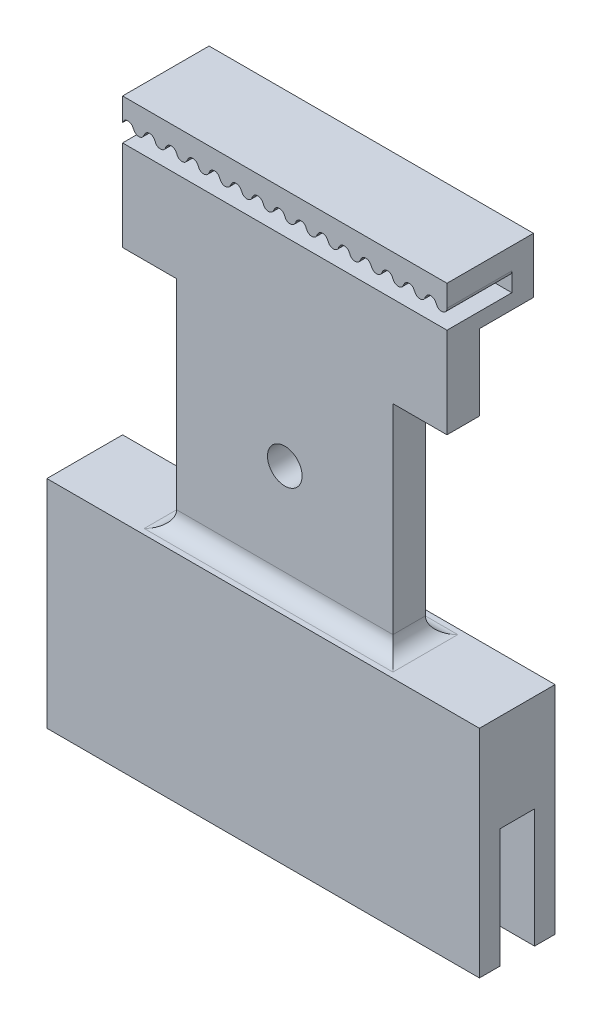
from build123d import *

# Parameters (mm, degrees)
IZIM1_W                          = 40
IZIM1_H                          = 7
Y_KSEKLIK_EKSTR_ZYON1_DEPTH      = 20
IZIM2_W                          = 40
IZIM2_H                          = 3.2
KES_EKSTR_ZYON1_DEPTH            = 11
Y_KSEKLIK_EKSTR_ZYON2_DEPTH      = 1.5
Y_KSEKLIK_EKSTR_ZYON2_DEPTH_BACK = 1.5
IZIM4_W                          = 20
IZIM4_H                          = 20
IZIM4_R                          = 1.6
RADYUS1_R                        = 1.5
IZIM7_W                          = 30
IZIM7_H                          = 3
Y_KSEKLIK_EKSTR_ZYON4_DEPTH      = 7
Y_KSEKLIK_EKSTR_ZYON6_DEPTH      = 3
Y_KSEKLIK_EKSTR_ZYON6_DEPTH_BACK = 3
IZIM9_W                          = 30
IZIM9_H                          = 1.38
IZIM10_W                         = 30
IZIM10_H                         = 5.14
Y_KSEKLIK_EKSTR_ZYON7_DEPTH      = 2


with BuildPart() as part:
    # Çizim1 → Yükseklik-Ekstrüzyon1 (new body)
    with BuildSketch(Plane(origin=(0, 0, 0), x_dir=(1, 0, 0), z_dir=(0, 1, 0))):
        Rectangle(IZIM1_W, IZIM1_H)
    extrude(amount=-Y_KSEKLIK_EKSTR_ZYON1_DEPTH)

    # Çizim2 → Kes-Ekstrüzyon1 (cut)
    with BuildSketch(Plane.XZ.offset(20)):
        Rectangle(IZIM2_W, IZIM2_H)
    extrude(amount=-KES_EKSTR_ZYON1_DEPTH, mode=Mode.SUBTRACT)

    # Çizim4 → Yükseklik-Ekstrüzyon2 (add, two sides: drawn at the far end of the back side and taken through both)
    with BuildSketch(Plane.XY.offset(-Y_KSEKLIK_EKSTR_ZYON2_DEPTH_BACK)):
        with Locations((0, 10)):
            Rectangle(IZIM4_W, IZIM4_H)
        with Locations((0, 10)):
            Circle(IZIM4_R, mode=Mode.SUBTRACT)
    extrude(amount=Y_KSEKLIK_EKSTR_ZYON2_DEPTH + Y_KSEKLIK_EKSTR_ZYON2_DEPTH_BACK)

    # Radyus1
    radyus1_edges = [part.edges().sort_by_distance(p)[0] for p in [
        (-10, 0, 0),
        (10, 0, 0),
        (0, 0, -1.5),
        (0, 0, 1.5),
    ]]
    fillet(radyus1_edges, radius=RADYUS1_R)

    # Çizim7 → Yükseklik-Ekstrüzyon4 (add)
    with BuildSketch(Plane(origin=(0, 20, 0), x_dir=(1, 0, 0), z_dir=(0, 1, 0))):
        Rectangle(IZIM7_W, IZIM7_H)
    extrude(amount=Y_KSEKLIK_EKSTR_ZYON4_DEPTH)

    # Çizim9 → Yükseklik-Ekstrüzyon6 (add, two sides: drawn at the far end of the back side and taken through both)
    with BuildSketch(Plane(origin=(0, 0, -1.5), x_dir=(-1, 0, 0), z_dir=(0, 0, -1)).offset(-Y_KSEKLIK_EKSTR_ZYON6_DEPTH_BACK)):
        with BuildLine():
            Line((15, 32.14), (-15, 32.14))
            Line((-15, 32.14), (-15, 30.13))
            ThreePointArc((-15, 30.13), (-14.856482323, 29.783517677), (-14.51, 29.64))
            Line((-14.51, 29.64), (-14.49, 29.64))
            ThreePointArc((-14.49, 29.64), (-14.181169533, 29.749574261), (-14.010460986, 30.029290846))
            Line((-14.010460986, 30.029290846), (-13.982635036, 30.029290846))
            ThreePointArc((-13.982635036, 30.029290846), (-13.807277215, 30.289520548), (-13.51, 30.39))
            Line((-13.51, 30.39), (-13.49, 30.39))
            ThreePointArc((-13.49, 30.39), (-13.192722785, 30.289520548), (-13.017364964, 30.029290846))
            Line((-13.017364964, 30.029290846), (-12.989539014, 30.029290846))
            ThreePointArc((-12.989539014, 30.029290846), (-12.818830467, 29.749574261), (-12.51, 29.64))
            Line((-12.51, 29.64), (-12.49, 29.64))
            ThreePointArc((-12.49, 29.64), (-12.181169533, 29.749574261), (-12.010460986, 30.029290846))
            Line((-12.010460986, 30.029290846), (-11.982635036, 30.029290846))
            ThreePointArc((-11.982635036, 30.029290846), (-11.807277215, 30.289520548), (-11.51, 30.39))
            Line((-11.51, 30.39), (-11.49, 30.39))
            ThreePointArc((-11.49, 30.39), (-11.192722785, 30.289520548), (-11.017364964, 30.029290846))
            Line((-11.017364964, 30.029290846), (-10.989539014, 30.029290846))
            ThreePointArc((-10.989539014, 30.029290846), (-10.818830467, 29.749574261), (-10.51, 29.64))
            Line((-10.51, 29.64), (-10.49, 29.64))
            ThreePointArc((-10.49, 29.64), (-10.181169533, 29.749574261), (-10.010460986, 30.029290846))
            Line((-10.010460986, 30.029290846), (-9.982635036, 30.029290846))
            ThreePointArc((-9.982635036, 30.029290846), (-9.807277215, 30.289520548), (-9.51, 30.39))
            Line((-9.51, 30.39), (-9.49, 30.39))
            ThreePointArc((-9.49, 30.39), (-9.192722785, 30.289520548), (-9.017364964, 30.029290846))
            Line((-9.017364964, 30.029290846), (-8.989539014, 30.029290846))
            ThreePointArc((-8.989539014, 30.029290846), (-8.818830467, 29.749574261), (-8.51, 29.64))
            Line((-8.51, 29.64), (-8.49, 29.64))
            ThreePointArc((-8.49, 29.64), (-8.181169533, 29.749574261), (-8.010460986, 30.029290846))
            Line((-8.010460986, 30.029290846), (-7.982635036, 30.029290846))
            ThreePointArc((-7.982635036, 30.029290846), (-7.807277215, 30.289520548), (-7.51, 30.39))
            Line((-7.51, 30.39), (-7.49, 30.39))
            ThreePointArc((-7.49, 30.39), (-7.192722785, 30.289520548), (-7.017364964, 30.029290846))
            Line((-7.017364964, 30.029290846), (-6.989539014, 30.029290846))
            ThreePointArc((-6.989539014, 30.029290846), (-6.818830467, 29.749574261), (-6.51, 29.64))
            Line((-6.51, 29.64), (-6.49, 29.64))
            ThreePointArc((-6.49, 29.64), (-6.181169533, 29.749574261), (-6.010460986, 30.029290846))
            Line((-6.010460986, 30.029290846), (-5.982635036, 30.029290846))
            ThreePointArc((-5.982635036, 30.029290846), (-5.807277215, 30.289520548), (-5.51, 30.39))
            Line((-5.51, 30.39), (-5.49, 30.39))
            ThreePointArc((-5.49, 30.39), (-5.192722785, 30.289520548), (-5.017364964, 30.029290846))
            Line((-5.017364964, 30.029290846), (-4.989539014, 30.029290846))
            ThreePointArc((-4.989539014, 30.029290846), (-4.818830467, 29.749574261), (-4.51, 29.64))
            Line((-4.51, 29.64), (-4.49, 29.64))
            ThreePointArc((-4.49, 29.64), (-4.181169533, 29.749574261), (-4.010460986, 30.029290846))
            Line((-4.010460986, 30.029290846), (-3.982635036, 30.029290846))
            ThreePointArc((-3.982635036, 30.029290846), (-3.807277215, 30.289520548), (-3.51, 30.39))
            Line((-3.51, 30.39), (-3.49, 30.39))
            ThreePointArc((-3.49, 30.39), (-3.192722785, 30.289520548), (-3.017364964, 30.029290846))
            Line((-3.017364964, 30.029290846), (-2.989539014, 30.029290846))
            ThreePointArc((-2.989539014, 30.029290846), (-2.818830467, 29.749574261), (-2.51, 29.64))
            Line((-2.51, 29.64), (-2.49, 29.64))
            ThreePointArc((-2.49, 29.64), (-2.181169533, 29.749574261), (-2.010460986, 30.029290846))
            Line((-2.010460986, 30.029290846), (-1.982635036, 30.029290846))
            ThreePointArc((-1.982635036, 30.029290846), (-1.807277215, 30.289520548), (-1.51, 30.39))
            Line((-1.51, 30.39), (-1.49, 30.39))
            ThreePointArc((-1.49, 30.39), (-1.192722785, 30.289520548), (-1.017364964, 30.029290846))
            Line((-1.017364964, 30.029290846), (-0.989539014, 30.029290846))
            ThreePointArc((-0.989539014, 30.029290846), (-0.818830467, 29.749574261), (-0.51, 29.64))
            Line((-0.51, 29.64), (-0.49, 29.64))
            ThreePointArc((-0.49, 29.64), (-0.181169533, 29.749574261), (-0.010460986, 30.029290846))
            Line((-0.010460986, 30.029290846), (0.017364964, 30.029290846))
            ThreePointArc((0.017364964, 30.029290846), (0.192722785, 30.289520548), (0.49, 30.39))
            Line((0.49, 30.39), (0.51, 30.39))
            ThreePointArc((0.51, 30.39), (0.807277215, 30.289520548), (0.982635036, 30.029290846))
            Line((0.982635036, 30.029290846), (1.010460986, 30.029290846))
            ThreePointArc((1.010460986, 30.029290846), (1.181169533, 29.749574261), (1.49, 29.64))
            Line((1.49, 29.64), (1.51, 29.64))
            ThreePointArc((1.51, 29.64), (1.818830467, 29.749574261), (1.989539014, 30.029290846))
            Line((1.989539014, 30.029290846), (2.017364964, 30.029290846))
            ThreePointArc((2.017364964, 30.029290846), (2.192722785, 30.289520548), (2.49, 30.39))
            Line((2.49, 30.39), (2.51, 30.39))
            ThreePointArc((2.51, 30.39), (2.807277215, 30.289520548), (2.982635036, 30.029290846))
            Line((2.982635036, 30.029290846), (3.010460986, 30.029290846))
            ThreePointArc((3.010460986, 30.029290846), (3.181169533, 29.749574261), (3.49, 29.64))
            Line((3.49, 29.64), (3.51, 29.64))
            ThreePointArc((3.51, 29.64), (3.818830467, 29.749574261), (3.989539014, 30.029290846))
            Line((3.989539014, 30.029290846), (4.017364964, 30.029290846))
            ThreePointArc((4.017364964, 30.029290846), (4.192722785, 30.289520548), (4.49, 30.39))
            Line((4.49, 30.39), (4.51, 30.39))
            ThreePointArc((4.51, 30.39), (4.807277215, 30.289520548), (4.982635036, 30.029290846))
            Line((4.982635036, 30.029290846), (5.010460986, 30.029290846))
            ThreePointArc((5.010460986, 30.029290846), (5.181169533, 29.749574261), (5.49, 29.64))
            Line((5.49, 29.64), (5.51, 29.64))
            ThreePointArc((5.51, 29.64), (5.818830467, 29.749574261), (5.989539014, 30.029290846))
            Line((5.989539014, 30.029290846), (6.017364964, 30.029290846))
            ThreePointArc((6.017364964, 30.029290846), (6.192722785, 30.289520548), (6.49, 30.39))
            Line((6.49, 30.39), (6.51, 30.39))
            ThreePointArc((6.51, 30.39), (6.807277215, 30.289520548), (6.982635036, 30.029290846))
            Line((6.982635036, 30.029290846), (7.010460986, 30.029290846))
            ThreePointArc((7.010460986, 30.029290846), (7.181169533, 29.749574261), (7.49, 29.64))
            Line((7.49, 29.64), (7.51, 29.64))
            ThreePointArc((7.51, 29.64), (7.818830467, 29.749574261), (7.989539014, 30.029290846))
            Line((7.989539014, 30.029290846), (8.017364964, 30.029290846))
            ThreePointArc((8.017364964, 30.029290846), (8.192722785, 30.289520548), (8.49, 30.39))
            Line((8.49, 30.39), (8.51, 30.39))
            ThreePointArc((8.51, 30.39), (8.807277215, 30.289520548), (8.982635036, 30.029290846))
            Line((8.982635036, 30.029290846), (9.010460986, 30.029290846))
            ThreePointArc((9.010460986, 30.029290846), (9.181169533, 29.749574261), (9.49, 29.64))
            Line((9.49, 29.64), (9.51, 29.64))
            ThreePointArc((9.51, 29.64), (9.818830467, 29.749574261), (9.989539014, 30.029290846))
            Line((9.989539014, 30.029290846), (10.017364964, 30.029290846))
            ThreePointArc((10.017364964, 30.029290846), (10.192722785, 30.289520548), (10.49, 30.39))
            Line((10.49, 30.39), (10.51, 30.39))
            ThreePointArc((10.51, 30.39), (10.807277215, 30.289520548), (10.982635036, 30.029290846))
            Line((10.982635036, 30.029290846), (11.010460986, 30.029290846))
            ThreePointArc((11.010460986, 30.029290846), (11.181169533, 29.749574261), (11.49, 29.64))
            Line((11.49, 29.64), (11.51, 29.64))
            ThreePointArc((11.51, 29.64), (11.818830467, 29.749574261), (11.989539014, 30.029290846))
            Line((11.989539014, 30.029290846), (12.017364964, 30.029290846))
            ThreePointArc((12.017364964, 30.029290846), (12.192722785, 30.289520548), (12.49, 30.39))
            Line((12.49, 30.39), (12.51, 30.39))
            ThreePointArc((12.51, 30.39), (12.807277215, 30.289520548), (12.982635036, 30.029290846))
            Line((12.982635036, 30.029290846), (13.010460986, 30.029290846))
            ThreePointArc((13.010460986, 30.029290846), (13.181169533, 29.749574261), (13.49, 29.64))
            Line((13.49, 29.64), (13.51, 29.64))
            ThreePointArc((13.51, 29.64), (13.818830467, 29.749574261), (13.989539014, 30.029290846))
            Line((13.989539014, 30.029290846), (14.017364964, 30.029290846))
            ThreePointArc((14.017364964, 30.029290846), (14.192722785, 30.289520548), (14.49, 30.39))
            Line((14.49, 30.39), (14.51, 30.39))
            ThreePointArc((14.51, 30.39), (14.807277215, 30.289520548), (14.982635036, 30.029290846))
            Line((14.982635036, 30.029290846), (15, 30.029290846))
            Line((15, 30.029290846), (15, 32.14))
        make_face()
        with Locations((0, 27.69)):
            Rectangle(IZIM9_W, IZIM9_H)
    extrude(amount=Y_KSEKLIK_EKSTR_ZYON6_DEPTH + Y_KSEKLIK_EKSTR_ZYON6_DEPTH_BACK)


with BuildPart() as y_kseklik_ekstr_zyon6_piece_1:
    # of the separate pieces the step leaves, piece 1, a body of its own (y_kseklik_ekstr_zyon6_pieces)
    add(part.part.solids().sort_by_distance((-15, 28.38, 1.5))[0])



with BuildPart() as y_kseklik_ekstr_zyon6_piece_2:
    # of the separate pieces the step leaves, piece 2, a body of its own (y_kseklik_ekstr_zyon6_pieces)
    add(part.part.solids().sort_by_distance((-14.017364964, 30.029290846, -4.5))[0])


with BuildPart() as y_kseklik_ekstr_zyon6_piece_1_1:
    add(y_kseklik_ekstr_zyon6_piece_1.part)

    add(y_kseklik_ekstr_zyon6_piece_2.part)  # Yükseklik-Ekstrüzyon7 merges Yükseklik-Ekstrüzyon6 piece 2
    # Çizim10 → Yükseklik-Ekstrüzyon7 (add)
    with BuildSketch(Plane(origin=(0, 0, -4.5), x_dir=(-1, 0, 0), z_dir=(0, 0, -1))):
        with Locations((0, 29.57)):
            Rectangle(IZIM10_W, IZIM10_H)
    extrude(amount=Y_KSEKLIK_EKSTR_ZYON7_DEPTH)


solid = y_kseklik_ekstr_zyon6_piece_1_1.part
